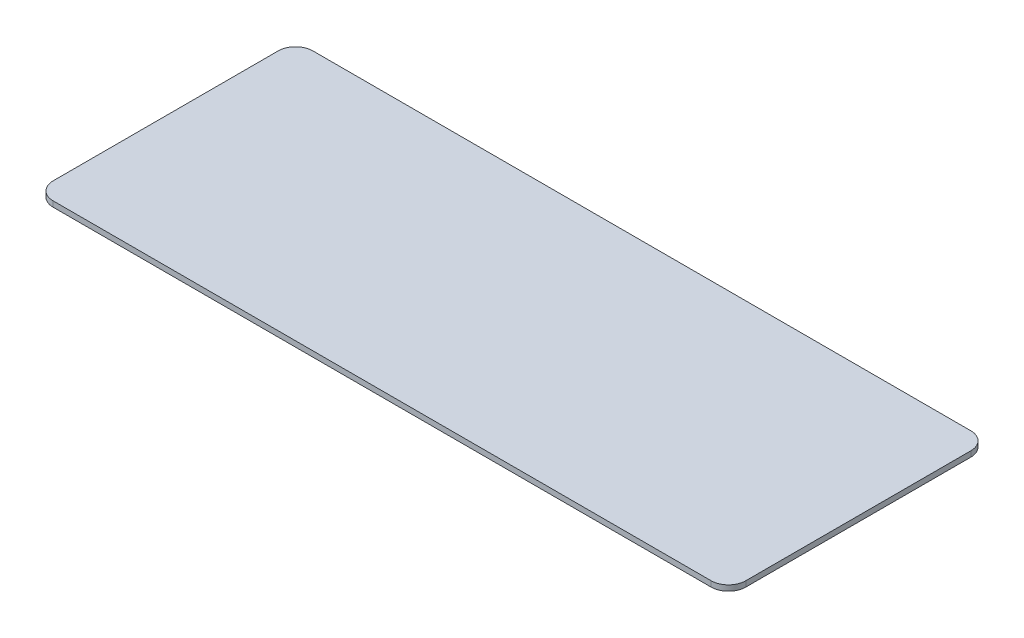
from build123d import *

# Parameters (mm, degrees)
SKETCH_1_W      = 200
SKETCH_1_H      = 75
EXTRUDE_1_DEPTH = 1.6
FILLET_1_R      = 5


with BuildPart() as part:
    # 草图1 → 凸台-拉伸1 (new body)
    with BuildSketch(Plane(origin=(0, 0, 0), x_dir=(1, 0, 0), z_dir=(0, 1, 0))):
        Rectangle(SKETCH_1_W, SKETCH_1_H)
    extrude(amount=EXTRUDE_1_DEPTH)

    # 圆角1
    fillet_1_edges = [part.edges().sort_by_distance(p)[0] for p in [
        (100, 0.8, 37.5),
        (-100, 0.8, 37.5),
        (-100, 0.8, -37.5),
        (100, 0.8, -37.5),
    ]]
    fillet(fillet_1_edges, radius=FILLET_1_R)


solid = part.part
